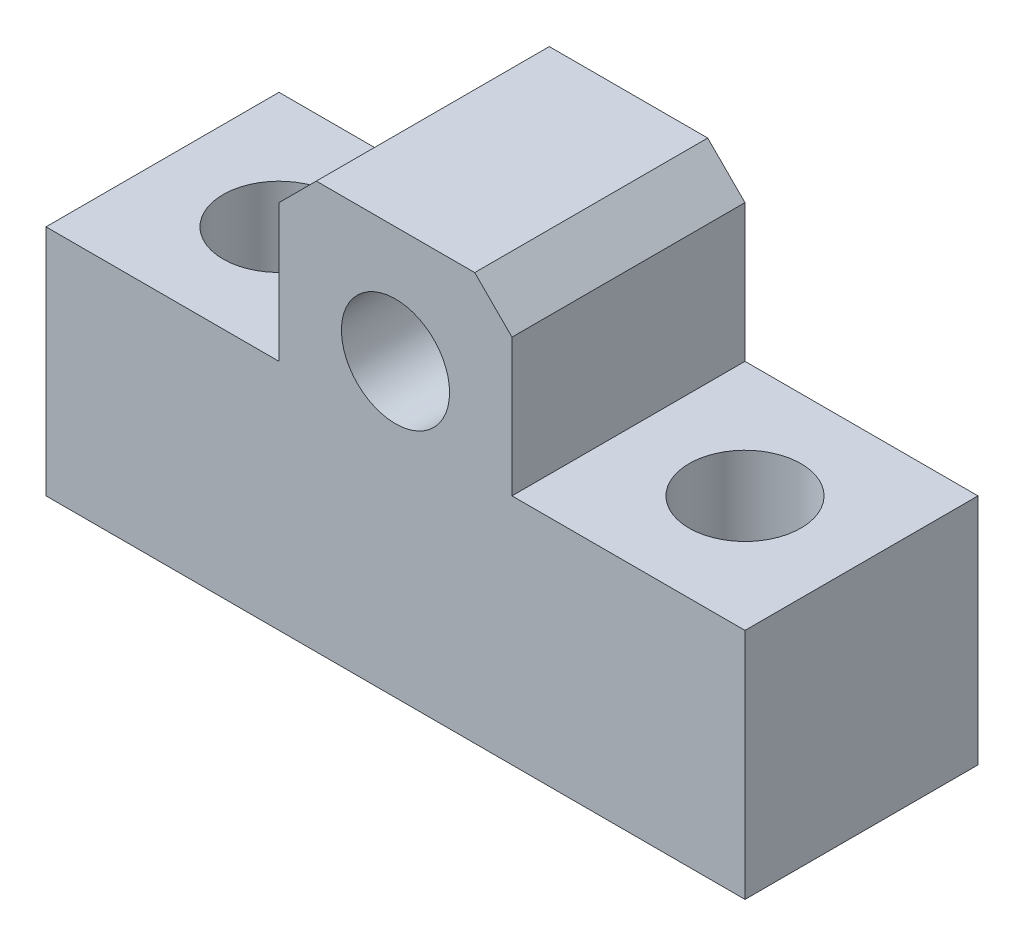
from build123d import *

# Parameters (mm, degrees)
SKETCH1_W                        = 19.05
SKETCH1_H                        = 6.35
BOSS_EXTRUDE1_DEPTH              = 6.35
SKETCH6_W                        = 6.35
SKETCH6_H                        = 6.35
BOSS_EXTRUDE2_DEPTH              = 4.7625
TAPPED_HOLE_FOR_4_40_HELICOIL1_D = 3.048
F_4_CLEARANCE_HOLE1_D            = 2.9464
DISTINGUISHINGMARK_SIZE          = 1.016


with BuildPart() as part:
    # Sketch1 → Boss-Extrude1 (new body)
    with BuildSketch(Plane.XY):
        Rectangle(SKETCH1_W, SKETCH1_H)
    extrude(amount=BOSS_EXTRUDE1_DEPTH)

    # Sketch6 → Boss-Extrude2 (add)
    with BuildSketch(Plane(origin=(0, 3.175, 0), x_dir=(1, 0, 0), z_dir=(0, 1, 0))):
        with Locations((0, -3.175)):
            Rectangle(SKETCH6_W, SKETCH6_H)
    extrude(amount=BOSS_EXTRUDE2_DEPTH)

    # Tapped Hole for #4-40 Helicoil1 (through all)
    with Locations(Plane(origin=(0, 3.175, 0), x_dir=(1, 0, 0), z_dir=(0, 1, 0))):
        with Locations((-6.35, -3.175), (6.35, -3.175)):
            Hole(TAPPED_HOLE_FOR_4_40_HELICOIL1_D / 2)

    # #4 Clearance Hole1 (through all)
    with Locations(Plane.XY.offset(6.35)):
        with Locations((0, 4.7625)):
            Hole(F_4_CLEARANCE_HOLE1_D / 2)

    # distinguishingMark
    distinguishingmark_edges = [part.edges().sort_by_distance(p)[0] for p in [
        (3.175, 7.9375, 3.175),
        (-3.175, 7.9375, 3.175),
    ]]
    chamfer(distinguishingmark_edges, length=DISTINGUISHINGMARK_SIZE)


solid = part.part
